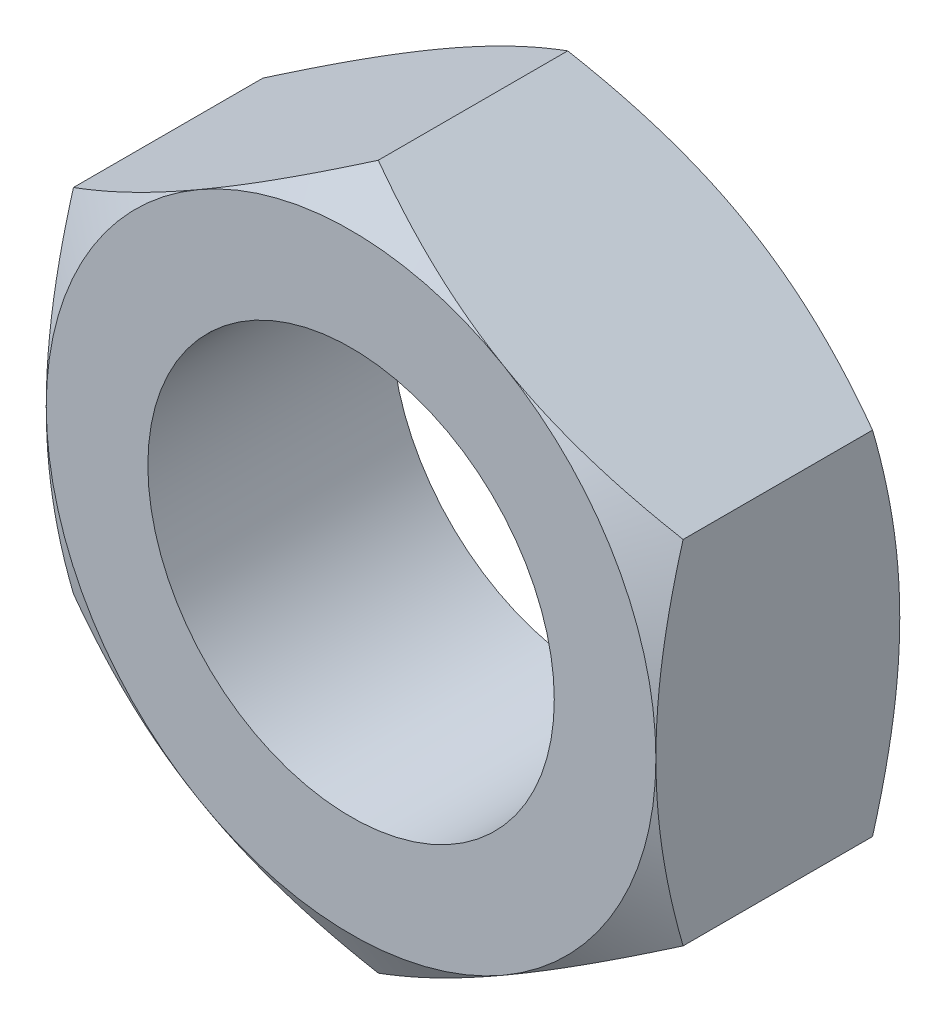
from build123d import *

# Parameters (mm, degrees)
BASE_EXTRUSION_DEPTH    = 12
ESQUISSE3_R             = 10
ENL_V_MAT_EXTRU_1_DEPTH = 26.865034313


with BuildPart() as part:
    # Esquisse1 → Base-Extrusion (new body)
    with BuildSketch(Plane.XY):
        Polygon((15, -8.660254038), (15, 8.660254038), (0, 17.320508076), (-15, 8.660254038), (-15, -8.660254038), (0, -17.320508076), align=None)
    extrude(amount=-BASE_EXTRUSION_DEPTH)

    # Esquisse2 → Enlèvement de matière-Révolution1 (revolve, cut)
    with BuildSketch(Plane(origin=(0, 0, 0), x_dir=(1, 0, 0), z_dir=(0, 1, 0))):
        Polygon((-15, 0), (-26.392304845, 0), (-26.392304845, 12), (-15, 12), (-25.392304845, 6), align=None)
    revolve(axis=Axis((0, 0, -12), (0, 0, 1)), mode=Mode.SUBTRACT)

    # Esquisse3 → Enlèv. mat.-Extru.1 (cut, through all)
    with BuildSketch(Plane.XY):
        Circle(ESQUISSE3_R)
    extrude(amount=-ENL_V_MAT_EXTRU_1_DEPTH, mode=Mode.SUBTRACT)


solid = part.part
